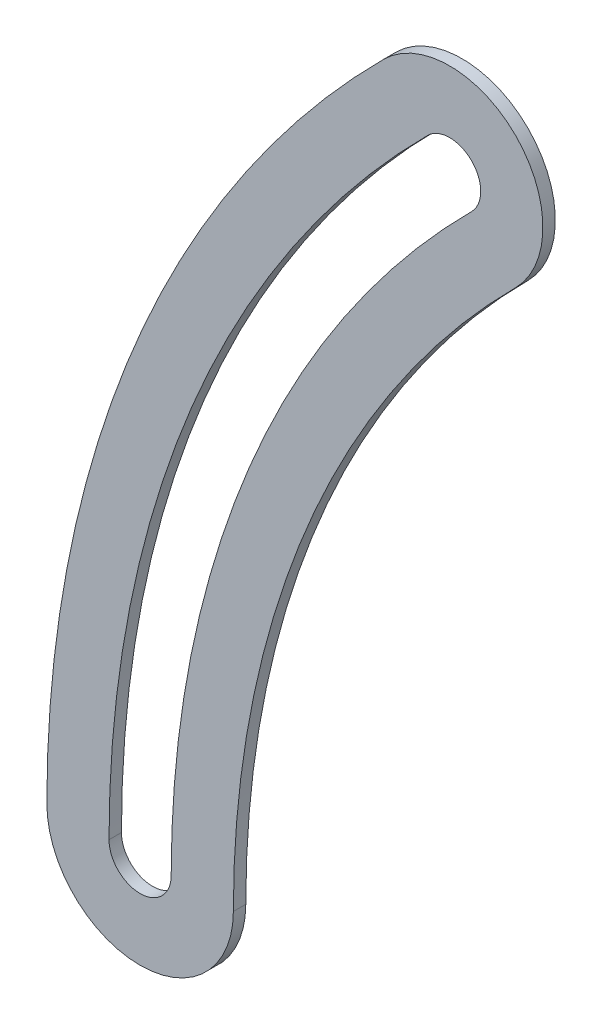
from build123d import *

# Parameters (mm, degrees)
EXTRUDE_1_DEPTH = 1


with BuildPart() as part:
    # Эскиз1 → Бобышка-Вытянуть1 (new body)
    with BuildSketch(Plane.XY):
        with BuildLine():
            ThreePointArc((-65.40737726, 65.40737726), (-85.458856757, 35.398217494), (-92.5, 0))
            ThreePointArc((-92.5, 0), (-85, -7.5), (-77.5, 0))
            ThreePointArc((-77.5, 0), (-71.60066377, 29.657966008), (-54.800775542, 54.800775542))
            ThreePointArc((-54.800775542, 54.800775542), (-54.800775542, 65.40737726), (-65.40737726, 65.40737726))
        make_face()
        with BuildLine():
            ThreePointArc((-61.871843354, 61.871843354), (-80.839459095, 33.484800332), (-87.5, 0))
            ThreePointArc((-87.5, 0), (-85, -2.5), (-82.5, 0))
            ThreePointArc((-82.5, 0), (-76.220061432, 31.57138317), (-58.336309448, 58.336309448))
            ThreePointArc((-58.336309448, 58.336309448), (-58.336309448, 61.871843354), (-61.871843354, 61.871843354))
        make_face(mode=Mode.SUBTRACT)
    extrude(amount=EXTRUDE_1_DEPTH)


solid = part.part
